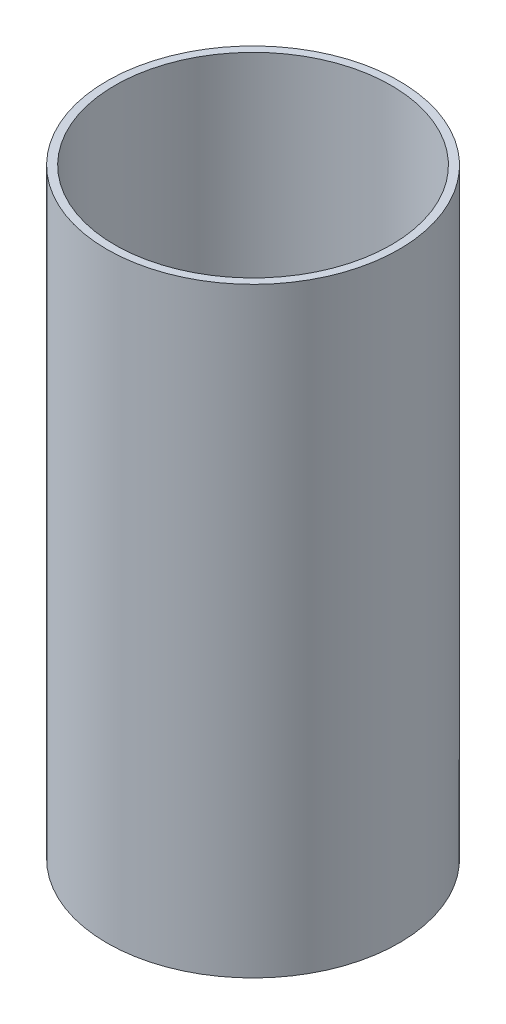
from build123d import *

# Parameters (mm, degrees)
CROQUIS1_R            = 70
CROQUIS1_R_2          = 66.25
EXTRUIR_L_MINA1_DEPTH = 288


with BuildPart() as part:
    # Croquis1 → Extruir-Lámina1 (new body)
    with BuildSketch(Plane(origin=(0, 0, 0), x_dir=(1, 0, 0), z_dir=(0, 1, 0))):
        Circle(CROQUIS1_R)
        Circle(CROQUIS1_R_2, mode=Mode.SUBTRACT)
    extrude(amount=EXTRUIR_L_MINA1_DEPTH)


solid = part.part
